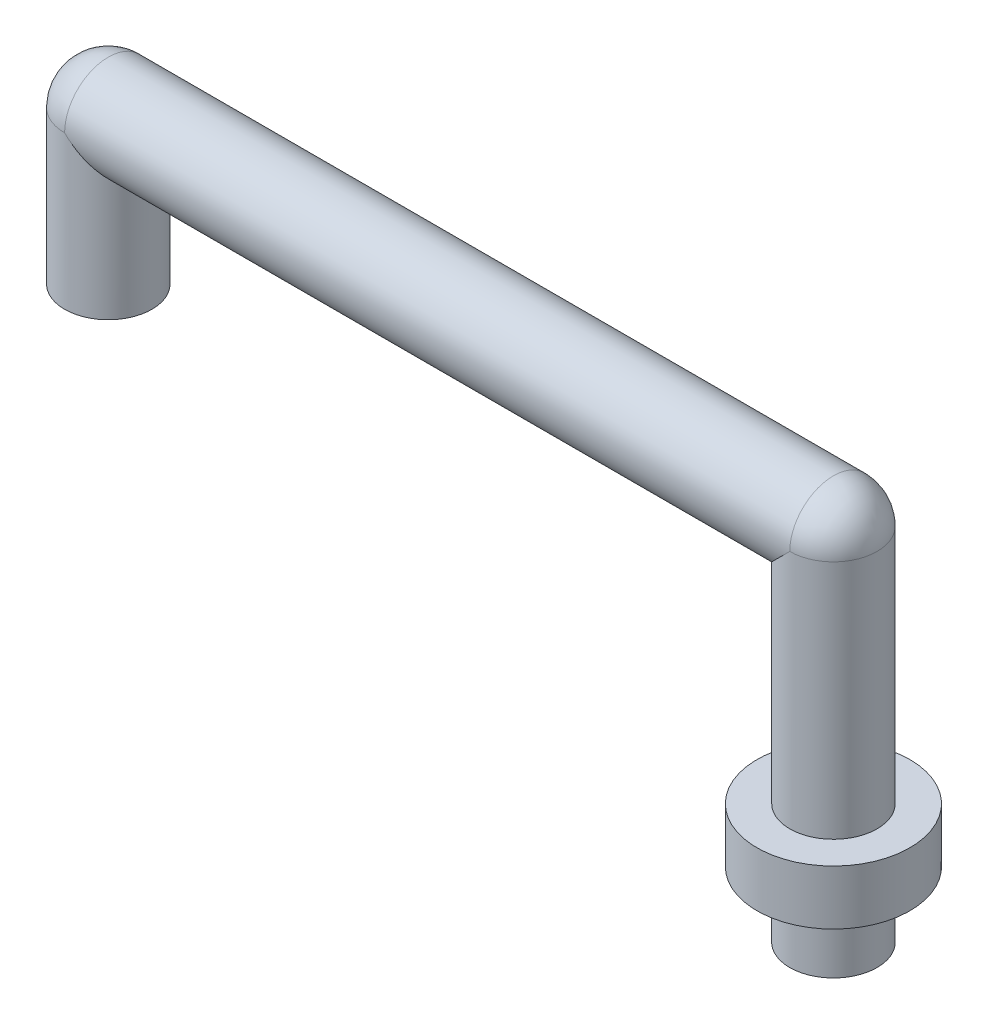
from build123d import *

# Parameters (mm, degrees)
SKETCH2_R           = 5.08
BOSS_EXTRUDE2_DEPTH = 41.91
SKETCH3_W           = 8.89
SKETCH3_H           = 6.35
SKETCH6_R           = 2.54
CUT_EXTRUDE1_DEPTH  = 17.78
SKETCH7_R           = 2.54
CUT_EXTRUDE2_DEPTH  = 19.05


with BuildPart() as part:
    # Sketch2 → Boss-Extrude2 (new body)
    with BuildSketch(Plane(origin=(0, 0, 0), x_dir=(-1, 0, 0), z_dir=(0, 1, 0))):
        with Locations(Location((0, 0, 0), (0, 0, 90))):
            Circle(SKETCH2_R)
    extrude(amount=BOSS_EXTRUDE2_DEPTH)

    # Sketch3 → Revolve1 (revolve)
    with BuildSketch(Plane.XY, mode=Mode.PRIVATE) as revolve1_sk:
        with Locations((-4.445, 10.795)):
            Rectangle(SKETCH3_W, SKETCH3_H)
    revolve(revolve1_sk.sketch.rotate(Axis((0, 0, 0), (0, 1, 0)), 270), axis=Axis((0, 0, 0), (0, 1, 0)))

    # Sketch4 → Revolve2 (revolve)
    with BuildSketch(Plane(origin=(0, 41.91, 0), x_dir=(1, 0, 0), z_dir=(0, 1, 0)), mode=Mode.PRIVATE) as revolve2_sk:
        with BuildLine():
            Line((0, 5.08), (-84.328, 5.08))
            Line((-84.328, 5.08), (-84.328, 0))
            Line((-84.328, 0), (5.08, 0))
            ThreePointArc((5.08, 0), (3.592102448, 3.592102448), (0, 5.08))
        make_face()
    revolve(revolve2_sk.sketch.rotate(Axis((-84.328, 41.91, 0), (1, 0, 0)), 180), axis=Axis((-84.328, 41.91, 0), (1, 0, 0)))

    # Sketch5 → Revolve3 (revolve)
    with BuildSketch(Plane.ZY.offset(84.328), mode=Mode.PRIVATE) as revolve3_sk:
        with BuildLine():
            Line((0, 46.99), (0, 24.13))
            Line((0, 24.13), (-5.08, 24.13))
            Line((-5.08, 24.13), (-5.08, 41.91))
            ThreePointArc((-5.08, 41.91), (-3.592102448, 45.502102448), (0, 46.99))
        make_face()
    revolve(revolve3_sk.sketch.rotate(Axis((-84.328, 46.99, 0), (0, -1, 0)), 180), axis=Axis((-84.328, 46.99, 0), (0, -1, 0)))

    # Sketch6 → Cut-Extrude1 (cut)
    with BuildSketch(Plane.XZ.offset(-24.13)):
        with Locations(Location((-84.328, 0, 0), (0, 0, 270))):
            Circle(SKETCH6_R)
    extrude(amount=-CUT_EXTRUDE1_DEPTH, mode=Mode.SUBTRACT)

    # Sketch7 → Cut-Extrude2 (cut)
    with BuildSketch(Plane.XZ):
        with Locations(Location((0, 0, 0), (0, 0, 270))):
            Circle(SKETCH7_R)
    extrude(amount=-CUT_EXTRUDE2_DEPTH, mode=Mode.SUBTRACT)


solid = part.part
